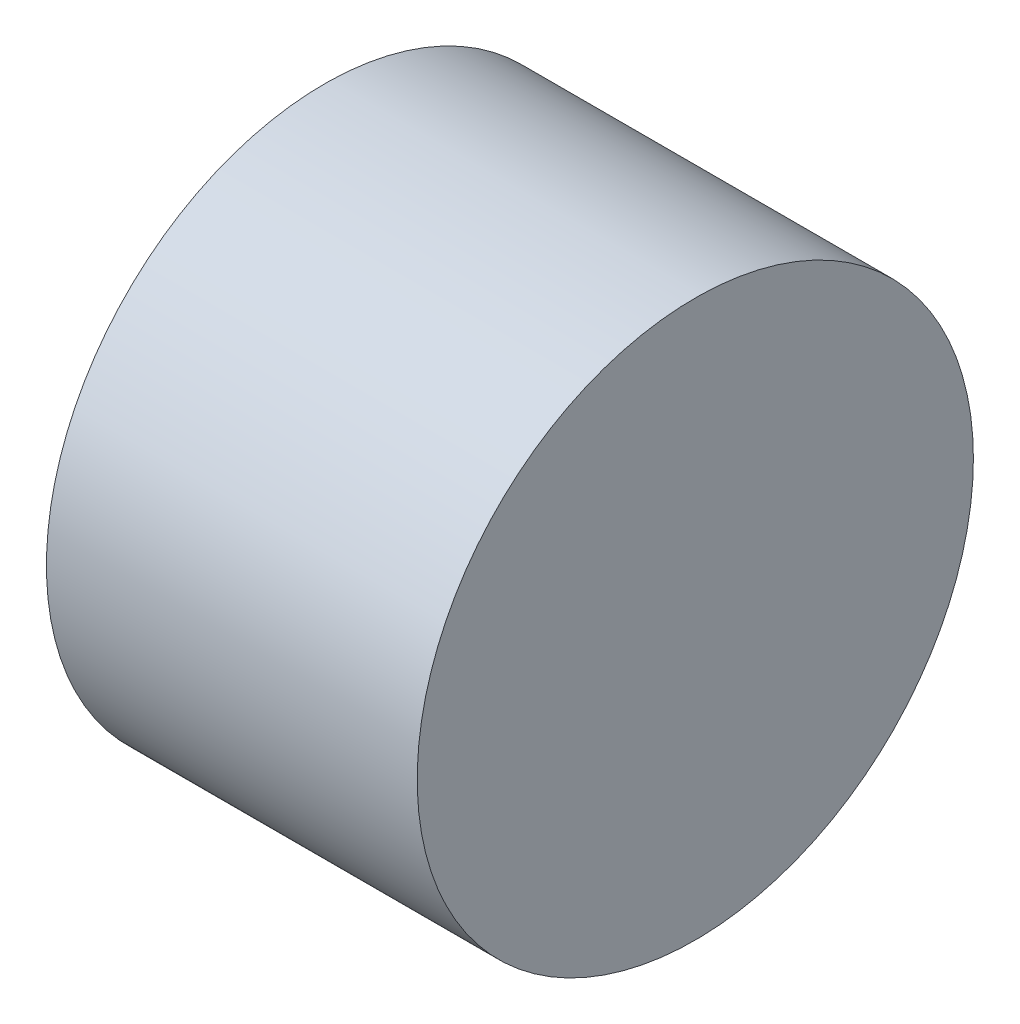
from build123d import *

# Parameters (mm, degrees)
BOSS_EXTRUDE1_DEPTH      = 50
BOSS_EXTRUDE1_DEPTH_BACK = 50
SKETCH1_R                = 75


with BuildPart() as part:
    # Sketch1 → Boss-Extrude1 (new, two sides: drawn at the far end of the back side and taken through both)
    with BuildSketch(Plane(origin=(0, 0, 0), x_dir=(0, 0, -1), z_dir=(1, 0, 0)).offset(-BOSS_EXTRUDE1_DEPTH_BACK)):
        Circle(SKETCH1_R)
    extrude(amount=BOSS_EXTRUDE1_DEPTH + BOSS_EXTRUDE1_DEPTH_BACK)


solid = part.part
